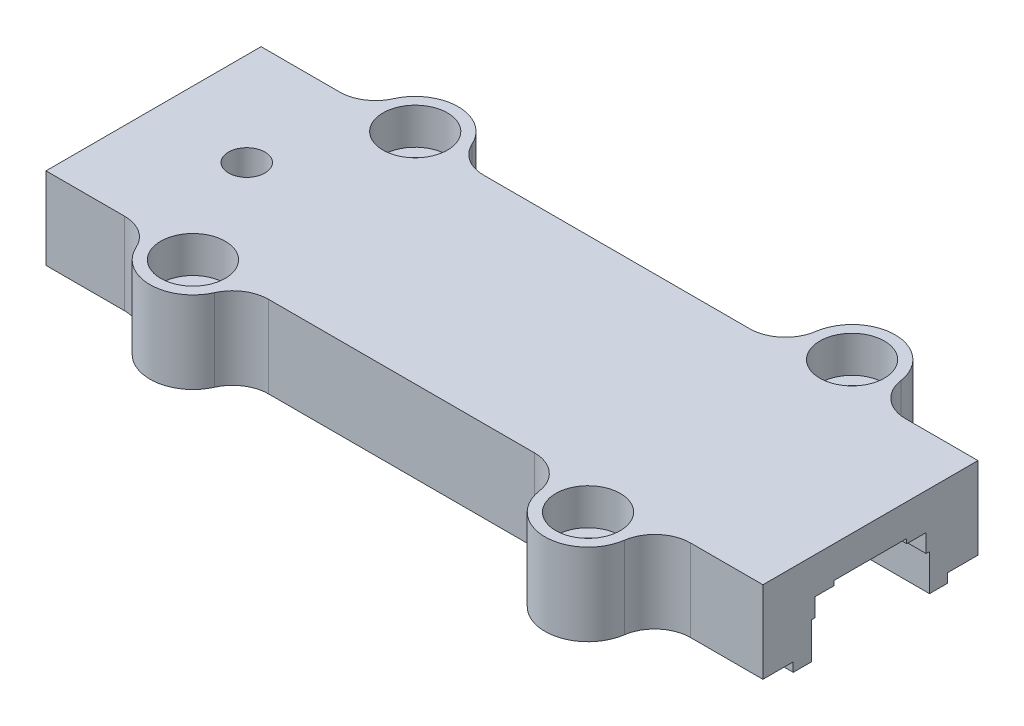
from build123d import *

# Parameters (mm, degrees)
SKETCH1_W           = 100
SKETCH1_H           = 30
BOSS_EXTRUDE1_DEPTH = 12.7
SKETCH2_W           = 15.2
SKETCH2_H           = 7.62
CUT_EXTRUDE1_DEPTH  = 102.913149299
SKETCH3_W           = 0.635
SKETCH3_H           = 5.08
SKETCH3_W_2         = 10.12
SKETCH3_H_2         = 0.635
CUT_EXTRUDE2_DEPTH  = 102.913149299
BOSS_EXTRUDE2_REACH = 103.913
SKETCH4_W           = 5
SKETCH4_H           = 16.47
FILLET7_R           = 1.5875
FILLET8_R           = 1.5875
BOSS_EXTRUDE3_REACH = 103.405
SKETCH9_W           = 19.05
SKETCH9_H           = 10.12
SKETCH7_R           = 2.54
CUT_EXTRUDE4_DEPTH  = 102.405445613
SKETCH10_R          = 3.429
CUT_EXTRUDE6_DEPTH  = 1.27
FILLET5_R           = 1.5875
BOSS_EXTRUDE4_DEPTH = 12.7
SKETCH12_R          = 4.5
CUT_EXTRUDE7_DEPTH  = 5.08
SKETCH13_R          = 2.75
CUT_EXTRUDE8_DEPTH  = 104.218974152
FILLET6_R           = 5
CUT_EXTRUDE9_START  = -1.27
CUT_EXTRUDE9_DEPTH  = 1.27
SKETCH25_W          = 3.175
SKETCH25_H          = 2.54
BOSS_EXTRUDE5_DEPTH = 2.54
BOSS_EXTRUDE6_REACH = 82.186
SKETCH26_W          = 2.54
SKETCH26_H          = 2.54
SKETCH31_W          = 0.1651
SKETCH31_H          = 2.54
ADJUST_DEPTH        = 72.14
FILLET9_R           = 1.5875


with BuildPart() as part:
    # Sketch1 → Boss-Extrude1 (new body)
    with BuildSketch(Plane(origin=(0, 0, 0), x_dir=(1, 0, 0), z_dir=(0, 1, 0))):
        with Locations((50, 0)):
            Rectangle(SKETCH1_W, SKETCH1_H)
    extrude(amount=BOSS_EXTRUDE1_DEPTH)

    # Sketch2 → Cut-Extrude1 (cut, through all)
    with BuildSketch(Plane(origin=(100, 0, 0), x_dir=(0, 0, -1), z_dir=(1, 0, 0))):
        with Locations((0, 3.81)):
            Rectangle(SKETCH2_W, SKETCH2_H)
    extrude(amount=-CUT_EXTRUDE1_DEPTH, mode=Mode.SUBTRACT)

    # Sketch3 → Cut-Extrude2 (cut, through all)
    with BuildSketch(Plane(origin=(100, 0, 0), x_dir=(0, 0, -1), z_dir=(1, 0, 0))):
        with Locations((-7.9175, 2.54)):
            Rectangle(SKETCH3_W, SKETCH3_H)
        with Locations((0, 7.9375)):
            Rectangle(SKETCH3_W_2, SKETCH3_H_2)
        with Locations((7.9175, 2.54)):
            Rectangle(SKETCH3_W, SKETCH3_H)
    extrude(amount=-CUT_EXTRUDE2_DEPTH, mode=Mode.SUBTRACT)

    # Sketch4 → Boss-Extrude2 (add, up to next)
    with BuildSketch(Plane.XZ, mode=Mode.PRIVATE) as boss_extrude2_sk1:
        with Locations((2.5, 0)):
            Rectangle(SKETCH4_W, SKETCH4_H)
    boss_extrude2_tool1 = extrude(boss_extrude2_sk1.sketch, amount=-BOSS_EXTRUDE2_REACH, mode=Mode.PRIVATE) - part.part
    add(boss_extrude2_tool1.solids().sort_by_distance((2.5, 0, 0))[0])

    # Fillet7
    fillet7_edges = [part.edges().sort_by_distance(p)[0] for p in [
        (5, 6.35, 7.6),
        (5, 6.35, -7.6),
    ]]
    fillet(fillet7_edges, radius=FILLET7_R)

    # Fillet8
    fillet8_edges = [part.edges().sort_by_distance(p)[0] for p in [
        (5, 2.54, 8.235),
        (5, 2.54, -8.235),
    ]]
    fillet(fillet8_edges, radius=FILLET8_R)

    # Sketch9 → Boss-Extrude3 (add, up to next)
    with BuildSketch(Plane.XZ.offset(-7.62), mode=Mode.PRIVATE) as boss_extrude3_sk1:
        with Locations((14.525, 0)):
            Rectangle(SKETCH9_W, SKETCH9_H)
    boss_extrude3_tool1 = extrude(boss_extrude3_sk1.sketch, amount=-BOSS_EXTRUDE3_REACH, mode=Mode.PRIVATE) - part.part
    add(boss_extrude3_tool1.solids().sort_by_distance((14.525, 7.62, 0))[0])

    # Sketch7 → Cut-Extrude4 (cut, through all)
    with BuildSketch(Plane.XZ.offset(-7.62)):
        with Locations(Location((13, 0, 0), (0, 0, 270))):
            Circle(SKETCH7_R)
    extrude(amount=-CUT_EXTRUDE4_DEPTH, mode=Mode.SUBTRACT)

    # Sketch10 → Cut-Extrude6 (cut)
    with BuildSketch(Plane.XZ.offset(-7.62)):
        with Locations(Location((13, 0, 0), (0, 0, 270))):
            Circle(SKETCH10_R)
    extrude(amount=-CUT_EXTRUDE6_DEPTH, mode=Mode.SUBTRACT)

    # Fillet5
    fillet5_edges = [part.edges().sort_by_distance(p)[0] for p in [
        (24.05, 7.9375, 5.06),
        (24.05, 7.9375, -5.06),
    ]]
    fillet(fillet5_edges, radius=FILLET5_R)

    # Sketch11 → Boss-Extrude4 (add)
    with BuildSketch(Plane(origin=(0, 12.7, 0), x_dir=(1, 0, 0), z_dir=(0, 1, 0))):
        with BuildLine():
            Line((73, -15), (73.022061133, -18.415))
            ThreePointArc((73.022061133, -18.415), (79.022061133, -24.415), (85.022061133, -18.415))
            Line((85.022061133, -18.415), (85, -15))
            Line((85, -15), (73, -15))
        make_face()
        with BuildLine():
            Line((27, -15.5), (27, -15))
            Line((27, -15), (15, -15))
            Line((15, -15), (15, -15.5))
            ThreePointArc((15, -15.5), (21, -21.5), (27, -15.5))
        make_face()
    boss_extrude4 = extrude(amount=-BOSS_EXTRUDE4_DEPTH)

    # Sketch12 → Cut-Extrude7 (cut)
    with BuildSketch(Plane(origin=(0, 12.7, 0), x_dir=(1, 0, 0), z_dir=(0, 1, 0))):
        with Locations(Location((21, -15.5, 0), (0, 0, 270))):
            Circle(SKETCH12_R)
        with Locations(Location((79.022061133, -18.415, 0), (0, 0, 270))):
            Circle(SKETCH12_R)
    cut_extrude7 = extrude(amount=-CUT_EXTRUDE7_DEPTH, mode=Mode.SUBTRACT)

    # Sketch13 → Cut-Extrude8 (cut, through all)
    with BuildSketch(Plane(origin=(0, 7.62, 0), x_dir=(1, 0, 0), z_dir=(0, 1, 0))):
        with Locations(Location((21, -15.5, 0), (0, 0, 270))):
            Circle(SKETCH13_R)
        with Locations(Location((79.022061133, -18.415, 0), (0, 0, 270))):
            Circle(SKETCH13_R)
    cut_extrude8 = extrude(amount=-CUT_EXTRUDE8_DEPTH, mode=Mode.SUBTRACT)

    # Mirror1: Boss-Extrude4, Cut-Extrude7, Cut-Extrude8 across plane
    add(boss_extrude4.mirror(Plane.XY))
    add(cut_extrude7.mirror(Plane.XY), mode=Mode.SUBTRACT)
    add(cut_extrude8.mirror(Plane.XY), mode=Mode.SUBTRACT)

    # Fillet6
    fillet6_edges = [part.edges().sort_by_distance(p)[0] for p in [
        (15, 6.35, 15),
        (27, 6.35, 15),
        (73, 6.35, 15),
        (85, 6.35, 15),
        (85, 6.35, -15),
        (73, 6.35, -15),
        (15, 6.35, -15),
        (27, 6.35, -15),
    ]]
    fillet(fillet6_edges, radius=FILLET6_R)

    # Sketch24 → Cut-Extrude9 (cut)
    with BuildSketch(Plane.XZ.offset(CUT_EXTRUDE9_START)):
        with BuildLine():
            Line((100, -10.775), (6.5875, -10.775))
            ThreePointArc((6.5875, -10.775), (3.668916761, -9.566083239), (2.46, -6.6475))
            Line((2.46, -6.6475), (2.46, 6.6475))
            ThreePointArc((2.46, 6.6475), (3.668916761, 9.566083239), (6.5875, 10.775))
            Line((6.5875, 10.775), (100, 10.775))
            Line((100, 10.775), (100, 15))
            Line((100, 15), (89.907270135, 15))
            ThreePointArc((89.907270135, 15), (86.636358391, 16.218315671), (84.959447861, 19.279545455))
            ThreePointArc((84.959447861, 19.279545455), (79.022061133, 24.415), (73.084674406, 19.279545455))
            ThreePointArc((73.084674406, 19.279545455), (71.407763876, 16.218315671), (68.136852132, 15))
            Line((68.136852132, 15), (31.03742995, 15))
            ThreePointArc((31.03742995, 15), (28.319643417, 15.803139702), (26.474961791, 17.954545455))
            ThreePointArc((26.474961791, 17.954545455), (21, 21.5), (15.525038209, 17.954545455))
            ThreePointArc((15.525038209, 17.954545455), (13.680356583, 15.803139702), (10.96257005, 15))
            Line((10.96257005, 15), (0, 15))
            Line((0, 15), (0, -15))
            Line((0, -15), (10.96257005, -15))
            ThreePointArc((10.96257005, -15), (13.680356583, -15.803139702), (15.525038209, -17.954545455))
            ThreePointArc((15.525038209, -17.954545455), (21, -21.5), (26.474961791, -17.954545455))
            ThreePointArc((26.474961791, -17.954545455), (28.319643417, -15.803139702), (31.03742995, -15))
            Line((31.03742995, -15), (68.136852132, -15))
            ThreePointArc((68.136852132, -15), (71.407763876, -16.218315671), (73.084674406, -19.279545455))
            ThreePointArc((73.084674406, -19.279545455), (79.022061133, -24.415), (84.959447861, -19.279545455))
            ThreePointArc((84.959447861, -19.279545455), (86.636358391, -16.218315671), (89.907270135, -15))
            Line((89.907270135, -15), (100, -15))
            Line((100, -15), (100, -10.775))
        make_face()
    extrude(amount=CUT_EXTRUDE9_DEPTH, mode=Mode.SUBTRACT)

    # Sketch25 → Boss-Extrude5 (add)
    with BuildSketch(Plane.XZ.offset(-7.62)):
        with Locations((26.2725, 6.33)):
            Rectangle(SKETCH25_W, SKETCH25_H)
        with Locations((26.2725, -6.33)):
            Rectangle(SKETCH25_W, SKETCH25_H)
    extrude(amount=BOSS_EXTRUDE5_DEPTH)

    # Sketch26 → Boss-Extrude6 (add, up to next)
    with BuildSketch(Plane.ZY.offset(-24.685), mode=Mode.PRIVATE) as boss_extrude6_sk1:
        with Locations((6.33, 6.35)):
            Rectangle(SKETCH26_W, SKETCH26_H)
    boss_extrude6_tool1 = extrude(boss_extrude6_sk1.sketch, amount=BOSS_EXTRUDE6_REACH, mode=Mode.PRIVATE) - part.part
    # Sketch26 → Boss-Extrude6 (add, up to next)
    with BuildSketch(Plane.ZY.offset(-24.685), mode=Mode.PRIVATE) as boss_extrude6_sk2:
        with Locations((-6.33, 6.35)):
            Rectangle(SKETCH26_W, SKETCH26_H)
    boss_extrude6_tool2 = extrude(boss_extrude6_sk2.sketch, amount=BOSS_EXTRUDE6_REACH, mode=Mode.PRIVATE) - part.part
    add(boss_extrude6_tool1.solids().sort_by_distance((24.685, 6.35, 6.33))[0])
    add(boss_extrude6_tool2.solids().sort_by_distance((24.685, 6.35, -6.33))[0])

    # Sketch31 → adjust (cut)
    with BuildSketch(Plane(origin=(100, 0, 0), x_dir=(0, 0, -1), z_dir=(1, 0, 0))):
        with Locations((7.68255, 6.35)):
            Rectangle(SKETCH31_W, SKETCH31_H)
        with Locations((-7.68255, 6.35)):
            Rectangle(SKETCH31_W, SKETCH31_H)
    extrude(amount=-ADJUST_DEPTH, mode=Mode.SUBTRACT)

    # Fillet9
    fillet9_edges = [part.edges().sort_by_distance(p)[0] for p in [
        (5, 6.35, 5.06),
        (5, 6.35, -5.06),
        (27.86, 6.35, 7.7651),
        (27.86, 6.35, -7.7651),
    ]]
    fillet(fillet9_edges, radius=FILLET9_R)


solid = part.part
